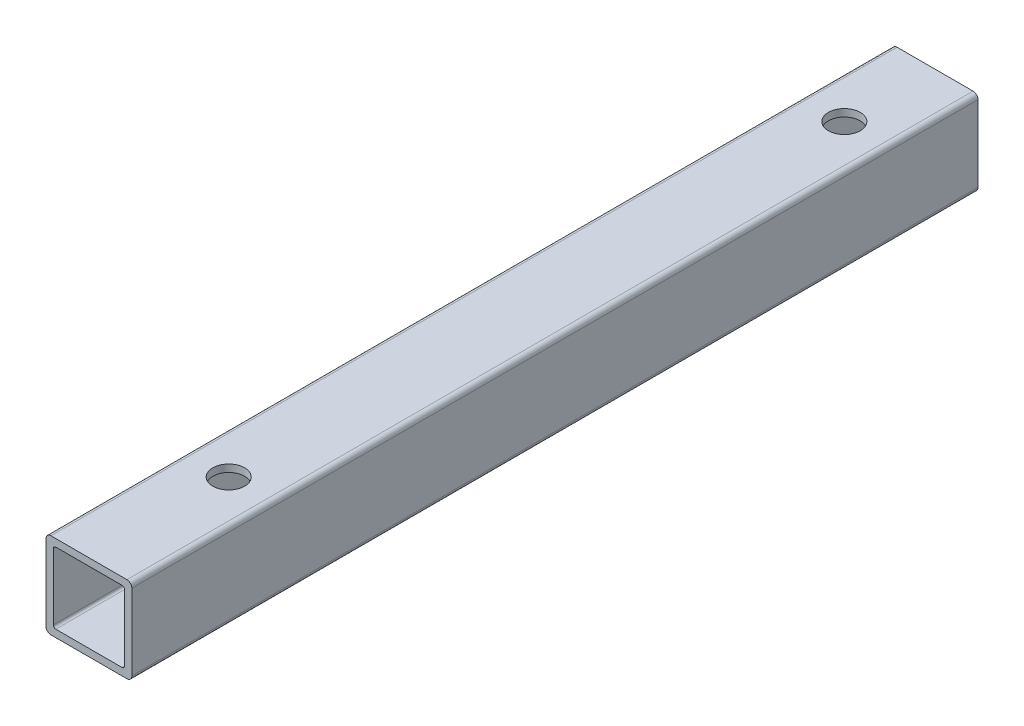
from build123d import *

# Parameters (mm, degrees)
DODANIE_WYCI_GNI_CIE1_DEPTH = 345
SZKIC2_R                    = 6.5
WYTNIJ_WYCI_GNI_CIE1_DEPTH  = 345


with BuildPart() as part:
    # Szkic1 → Dodanie-wyciągnięcie1 (new body)
    with BuildSketch(Plane.XY):
        with BuildLine():
            Line((2, 0), (33, 0))
            ThreePointArc((33, 0), (34.414213562, 0.585786438), (35, 2))
            Line((35, 2), (35, 33))
            ThreePointArc((35, 33), (34.414213562, 34.414213562), (33, 35))
            Line((33, 35), (2, 35))
            ThreePointArc((2, 35), (0.585786438, 34.414213562), (0, 33))
            Line((0, 33), (0, 2))
            ThreePointArc((0, 2), (0.585786438, 0.585786438), (2, 0))
        make_face()
        with BuildLine():
            Line((4, 3), (31, 3))
            ThreePointArc((31, 3), (31.707106781, 3.292893219), (32, 4))
            Line((32, 4), (32, 31))
            ThreePointArc((32, 31), (31.707106781, 31.707106781), (31, 32))
            Line((31, 32), (4, 32))
            ThreePointArc((4, 32), (3.292893219, 31.707106781), (3, 31))
            Line((3, 31), (3, 4))
            ThreePointArc((3, 4), (3.292893219, 3.292893219), (4, 3))
        make_face(mode=Mode.SUBTRACT)
    extrude(amount=DODANIE_WYCI_GNI_CIE1_DEPTH)

    # Szkic2 → Wytnij-wyciągnięcie1 (cut)
    with BuildSketch(Plane(origin=(0, 35, 0), x_dir=(1, 0, 0), z_dir=(0, 1, 0))):
        with Locations(Location((17.5, -288, 0), (0, 0, 270))):
            Circle(SZKIC2_R)
        with Locations(Location((17.5, -37, 0), (0, 0, 270))):
            Circle(SZKIC2_R)
    extrude(amount=-WYTNIJ_WYCI_GNI_CIE1_DEPTH, mode=Mode.SUBTRACT)


solid = part.part
